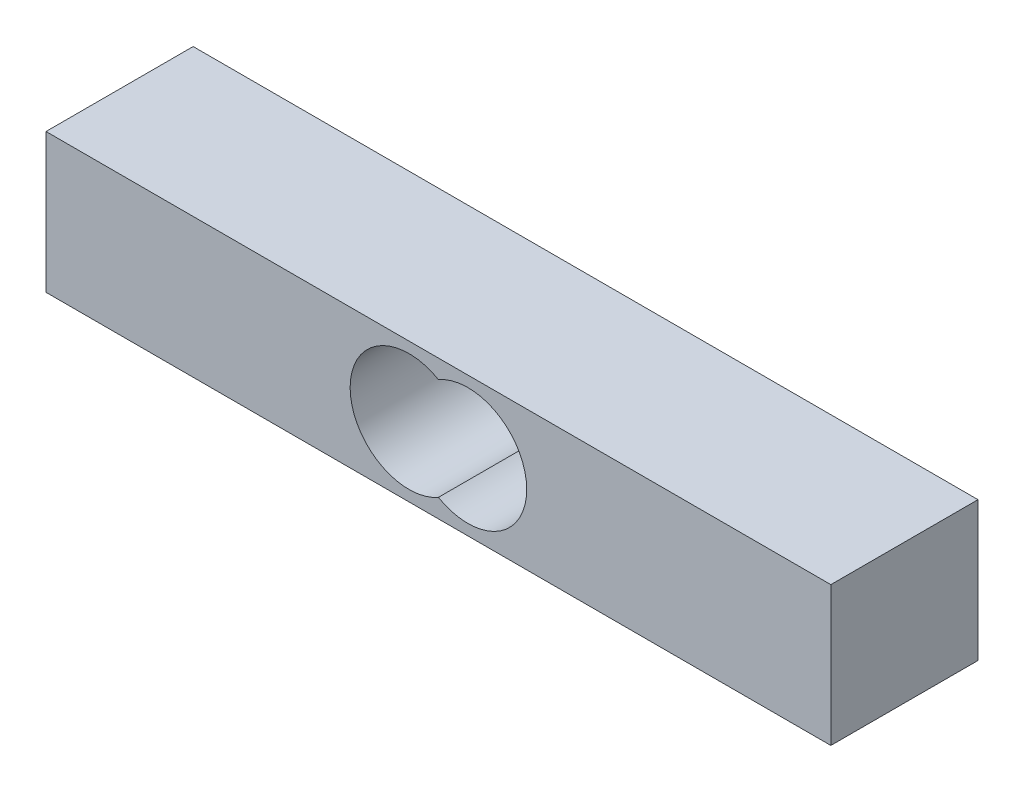
from build123d import *

# Parameters (mm, degrees)
SKETCH1_W           = 80
SKETCH1_H           = 15
BOSS_EXTRUDE1_DEPTH = 14.2
CUT_EXTRUDE1_DEPTH  = 46.018218534


with BuildPart() as part:
    # Sketch1 → Boss-Extrude1 (new body)
    with BuildSketch(Plane(origin=(0, 0, 0), x_dir=(1, 0, 0), z_dir=(0, 1, 0))):
        Rectangle(SKETCH1_W, SKETCH1_H)
    extrude(amount=BOSS_EXTRUDE1_DEPTH)

    # Sketch4 → Cut-Extrude1 (cut, through all)
    with BuildSketch(Plane.XY.offset(7.5)):
        with BuildLine():
            ThreePointArc((0, 1.903847577), (9, 7.1), (0, 12.296152423))
            ThreePointArc((0, 12.296152423), (-9, 7.1), (0, 1.903847577))
        make_face()
    extrude(amount=-CUT_EXTRUDE1_DEPTH, mode=Mode.SUBTRACT)


solid = part.part
